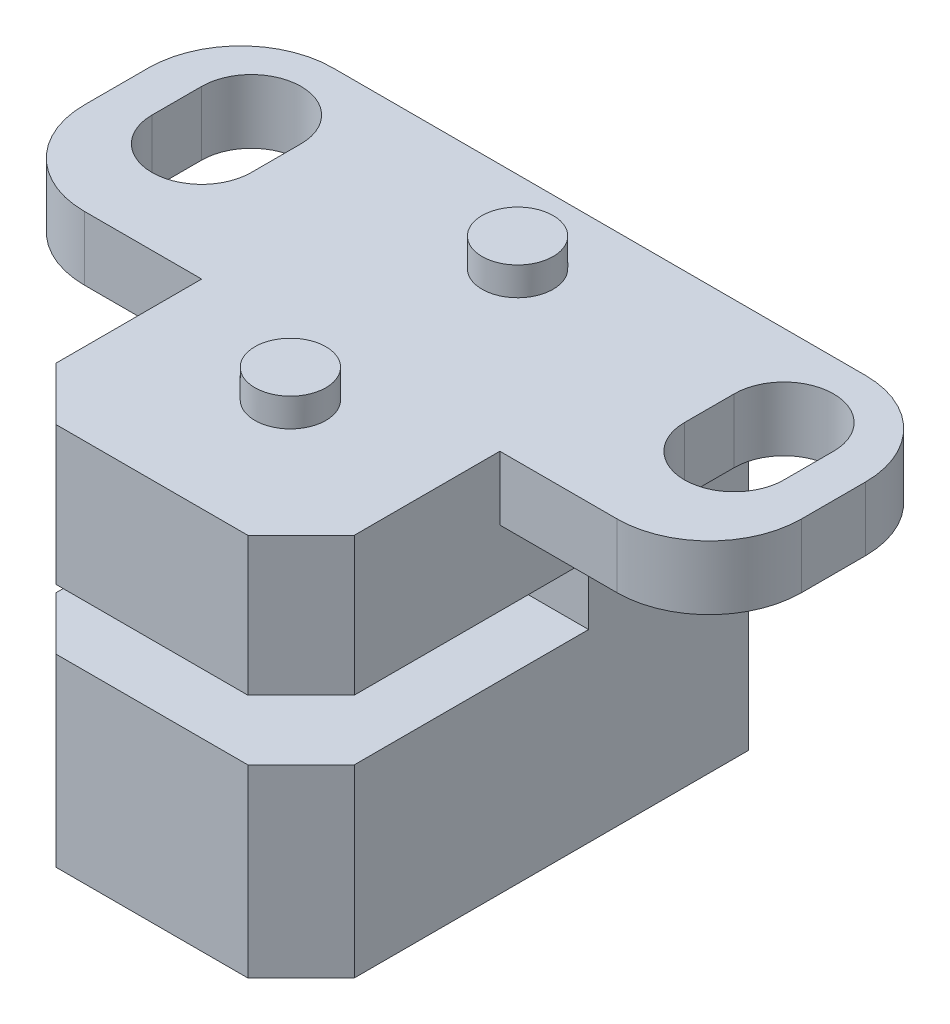
from build123d import *

# Parameters (mm, degrees)
BOSS_EXTRUDE1_DEPTH     = 10.8
BOSS_EXTRUDE2_DEPTH     = 1.8
CUT_EXTRUDE1_DEPTH      = 15.9231364
CUT_EXTRUDE2_DEPTH      = 19.995262567
CUT_EXTRUDE2_DEPTH_BACK = 19.995262567
SKETCH4_W               = 8.1
SKETCH4_H               = 1.7
SKETCH6_R               = 1
BOSS_EXTRUDE3_DEPTH     = 0.8


with BuildPart() as part:
    # Sketch1 → Boss-Extrude1 (new body)
    with BuildSketch(Plane(origin=(0, 0, 0), x_dir=(1, 0, 0), z_dir=(0, 1, 0))):
        Polygon((2.7, -6.3), (4.2, -4.8), (4.2, 6.3), (-4.2, 6.3), (-4.2, -4.8), (-2.7, -6.3), align=None)
    extrude(amount=BOSS_EXTRUDE1_DEPTH)

    # Sketch2 → Boss-Extrude2 (add)
    with BuildSketch(Plane(origin=(0, 10.8, 0), x_dir=(1, 0, 0), z_dir=(0, 1, 0))):
        with BuildLine():
            Line((-7.5, -0.7), (7.5, -0.7))
            ThreePointArc((7.5, -0.7), (9.338477631, 0.061522369), (10.1, 1.9))
            Line((10.1, 1.9), (10.1, 3.7))
            ThreePointArc((10.1, 3.7), (9.338477631, 5.538477631), (7.5, 6.3))
            Line((7.5, 6.3), (-7.5, 6.3))
            ThreePointArc((-7.5, 6.3), (-9.338477631, 5.538477631), (-10.1, 3.7))
            Line((-10.1, 3.7), (-10.1, 1.9))
            ThreePointArc((-10.1, 1.9), (-9.338477631, 0.061522369), (-7.5, -0.7))
        make_face()
    extrude(amount=-BOSS_EXTRUDE2_DEPTH)

    # Sketch3 → Cut-Extrude1 (cut, through all)
    with BuildSketch(Plane.XZ.offset(-9)):
        with BuildLine():
            Line((6.1, -4), (6.1, -2.6))
            ThreePointArc((6.1, -2.6), (7.5, -1.2), (8.9, -2.6))
            Line((8.9, -2.6), (8.9, -4))
            ThreePointArc((8.9, -4), (7.5, -5.4), (6.1, -4))
        make_face()
        with BuildLine():
            Line((-6.1, -4), (-6.1, -2.6))
            ThreePointArc((-6.1, -2.6), (-7.5, -1.2), (-8.9, -2.6))
            Line((-8.9, -2.6), (-8.9, -4))
            ThreePointArc((-8.9, -4), (-7.5, -5.4), (-6.1, -4))
        make_face()
    extrude(amount=-CUT_EXTRUDE1_DEPTH, mode=Mode.SUBTRACT)

    # Sketch4 → Cut-Extrude2 (cut, two sides: drawn at the far end of the back side and taken through both)
    with BuildSketch(Plane(origin=(4.2, 0, 0), x_dir=(0, 0, -1), z_dir=(1, 0, 0)).offset(-CUT_EXTRUDE2_DEPTH_BACK)):
        with Locations((-2.25, 6.05)):
            Rectangle(SKETCH4_W, SKETCH4_H)
    extrude(amount=CUT_EXTRUDE2_DEPTH + CUT_EXTRUDE2_DEPTH_BACK, mode=Mode.SUBTRACT)

    # Sketch6 → Boss-Extrude3 (add)
    with BuildSketch(Plane(origin=(0, 10.8, 0), x_dir=(1, 0, 0), z_dir=(0, 1, 0))):
        with Locations(Location((0, -2.4, 0), (0, 0, 90))):
            Circle(SKETCH6_R)
        with Locations(Location((0, 4, 0), (0, 0, 90))):
            Circle(SKETCH6_R)
    extrude(amount=BOSS_EXTRUDE3_DEPTH)


solid = part.part
